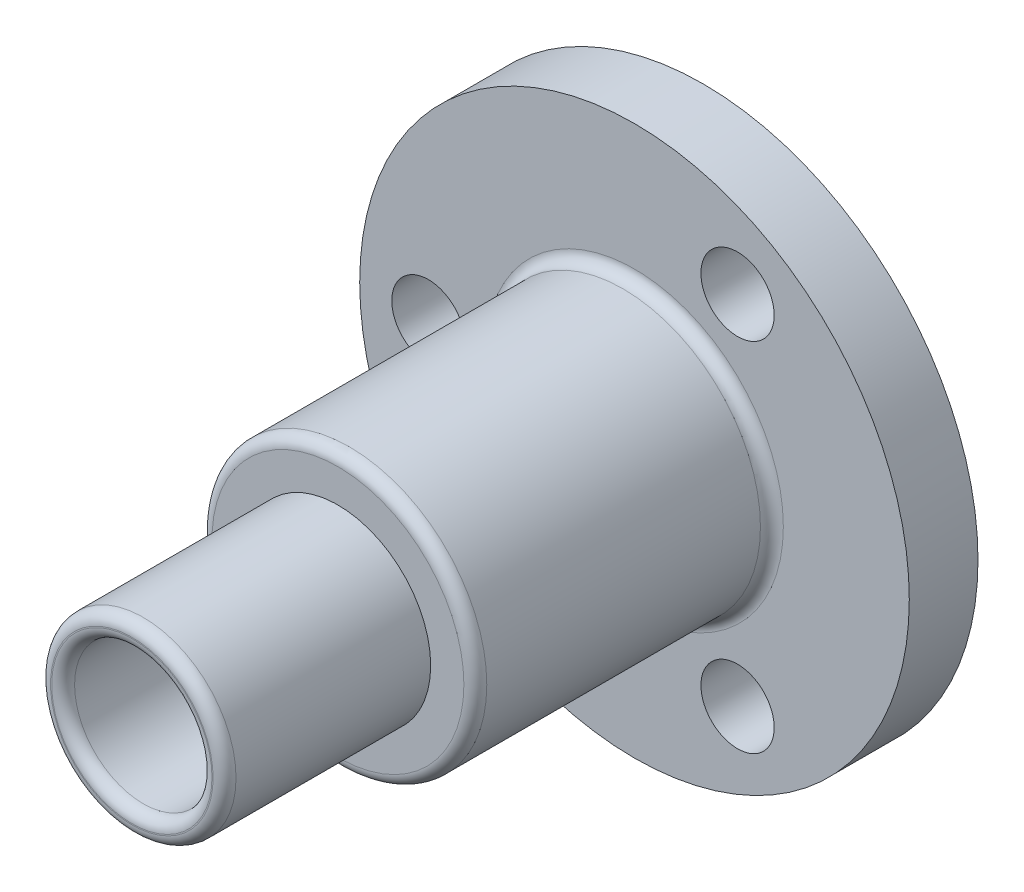
from build123d import *

# Parameters (mm, degrees)
CROQUIS1_R              = 12
CROQUIS1_R_2            = 1.6
CROQUIS1_R_3            = 3.5
SALIENTE_EXTRUIR1_DEPTH = 3
CROQUIS2_R              = 6
CROQUIS2_R_2            = 3
SALIENTE_EXTRUIR2_DEPTH = 12.95
CROQUIS3_R              = 4.05
CROQUIS3_R_2            = 3
SALIENTE_EXTRUIR3_DEPTH = 9
REDONDEO1_R             = 0.5


with BuildPart() as part:
    # Croquis1 → Saliente-Extruir1 (new body)
    with BuildSketch(Plane(origin=(0, 0, 0), x_dir=(0, 1, 0), z_dir=(0, 0, 1))):
        with Locations(Location((0, 0, 0), (0, 0, 270))):
            Circle(CROQUIS1_R)
        with Locations(Location((0, 9, 0), (0, 0, 270))):
            Circle(CROQUIS1_R_2, mode=Mode.SUBTRACT)
        with Locations(Location((7.794228634, -4.5, 0), (0, 0, 270))):
            Circle(CROQUIS1_R_2, mode=Mode.SUBTRACT)
        with Locations(Location((-7.794228634, -4.5, 0), (0, 0, 270))):
            Circle(CROQUIS1_R_2, mode=Mode.SUBTRACT)
        with Locations(Location((0, 0, 0), (0, 0, 270))):
            Circle(CROQUIS1_R_3, mode=Mode.SUBTRACT)
    extrude(amount=SALIENTE_EXTRUIR1_DEPTH)

    # Croquis2 → Saliente-Extruir2 (add)
    with BuildSketch(Plane.XY.offset(3)):
        with Locations(Location((0, 0, 0), (0, 0, 180))):
            Circle(CROQUIS2_R)
        with Locations(Location((0, 0, 0), (0, 0, 180))):
            Circle(CROQUIS2_R_2, mode=Mode.SUBTRACT)
    extrude(amount=SALIENTE_EXTRUIR2_DEPTH)

    # Croquis3 → Saliente-Extruir3 (add)
    with BuildSketch(Plane.XY.offset(15.95)):
        Circle(CROQUIS3_R)
        with Locations(Location((0, 0, 0), (0, 0, 180))):
            Circle(CROQUIS3_R_2, mode=Mode.SUBTRACT)
    extrude(amount=SALIENTE_EXTRUIR3_DEPTH)

    # Redondeo1
    redondeo1_edges = [part.edges().sort_by_distance(p)[0] for p in [
        (6, 0, 3),
        (6, 0, 15.95),
        (-4.05, 0, 24.95),
        (3, 0, 24.95),
    ]]
    fillet(redondeo1_edges, radius=REDONDEO1_R)


solid = part.part
